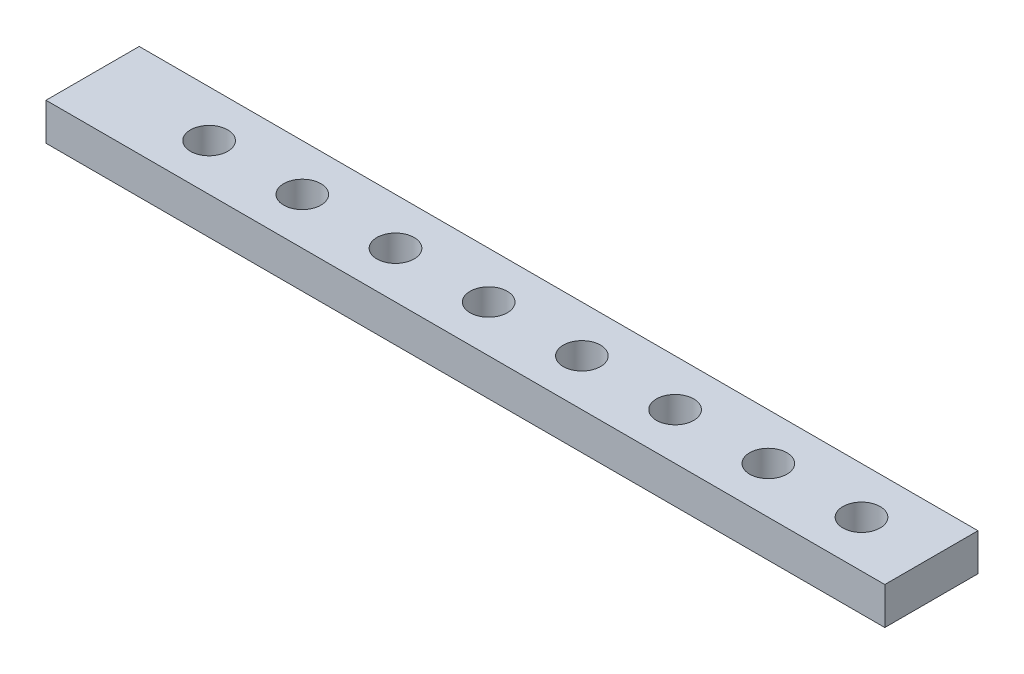
from build123d import *

# Parameters (mm, degrees)
SKETCH1_W           = 210
SKETCH1_H           = 20
BOSS_EXTRUDE1_DEPTH = 8
SKETCH2_R           = 4
CUT_EXTRUDE1_DEPTH  = 10
LPATTERN1_COUNT     = 8
LPATTERN1_PITCH     = 20
SKETCH4_W           = 80
SKETCH4_H           = 20
CUT_EXTRUDE2_DEPTH  = 10


with BuildPart() as part:
    # Sketch1 → Boss-Extrude1 (new body)
    with BuildSketch(Plane(origin=(0, 0, 0), x_dir=(1, 0, 0), z_dir=(0, 1, 0))):
        with Locations((105, 10)):
            Rectangle(SKETCH1_W, SKETCH1_H)
    extrude(amount=BOSS_EXTRUDE1_DEPTH)

    # Sketch2 → Cut-Extrude1 (cut)
    with BuildSketch(Plane(origin=(0, 8, 0), x_dir=(1, 0, 0), z_dir=(0, 1, 0))):
        with Locations(Location((195, 10, 0), (0, 0, 270))):
            Circle(SKETCH2_R)
    cut_extrude1 = extrude(amount=-CUT_EXTRUDE1_DEPTH, mode=Mode.SUBTRACT)

    # LPattern1: Cut-Extrude1 ×8
    with Locations(*[(-i * LPATTERN1_PITCH, 0, 0) for i in range(1, LPATTERN1_COUNT)]):
        add(cut_extrude1, mode=Mode.SUBTRACT)

    # Sketch4 → Cut-Extrude2 (cut)
    with BuildSketch(Plane(origin=(0, 0, 0), x_dir=(1, 0, 0), z_dir=(0, 1, 0))):
        with Locations((-10, 10)):
            Rectangle(SKETCH4_W, SKETCH4_H)
    extrude(amount=CUT_EXTRUDE2_DEPTH, mode=Mode.SUBTRACT)


solid = part.part
